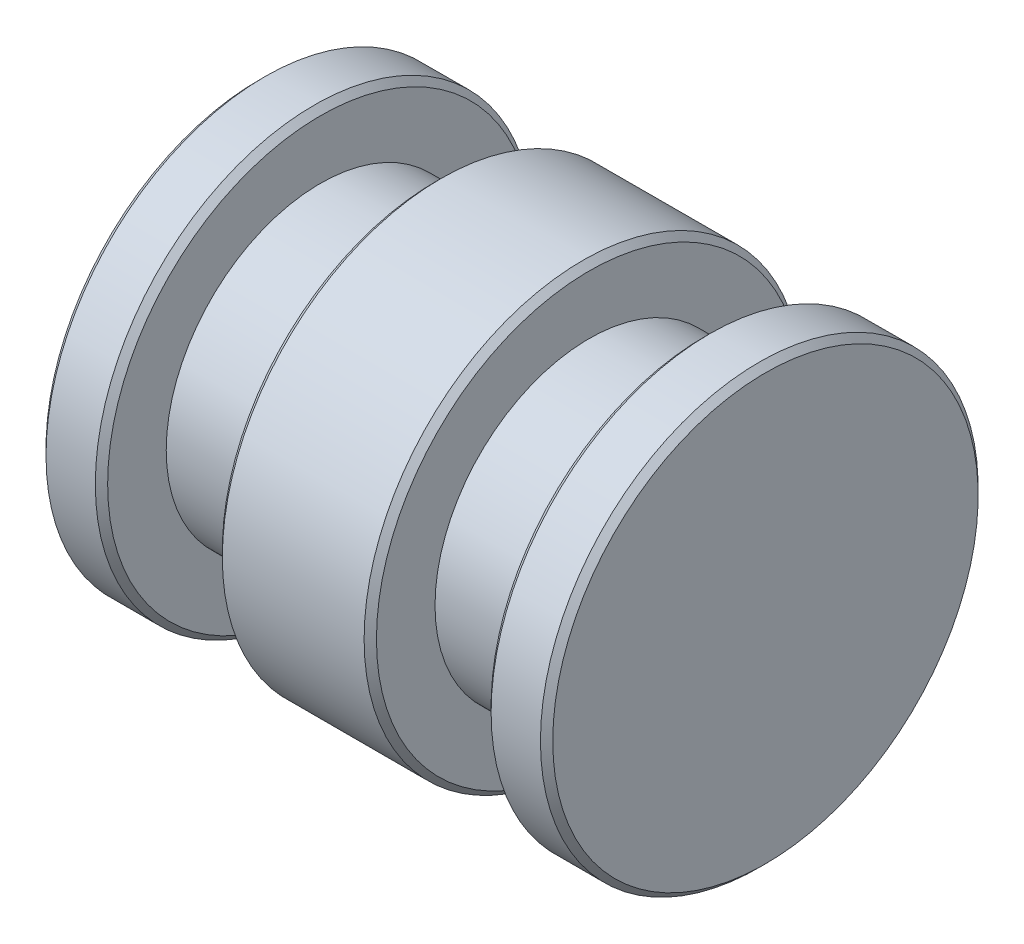
from build123d import *

# Parameters (mm, degrees)
VENT_EDGE_BREAK_SIZE = 0.127


with BuildPart() as part:
    # Sketch2 → Revolve1 (revolve)
    with BuildSketch(Plane.XY, mode=Mode.PRIVATE) as revolve1_sk:
        Polygon((3.6322, 4.5085), (3.6322, 3.175), (1.27, 3.175), (1.27, 4.5085), (0, 4.5085), (0, 0), (10.4394, 0), (10.4394, 4.5085), (9.1694, 4.5085), (9.1694, 3.175), (6.8072, 3.175), (6.8072, 4.5085), align=None)
    revolve(revolve1_sk.sketch.rotate(Axis((-1.617419624, 0, 0), (1, 0, 0)), 90), axis=Axis((-1.617419624, 0, 0), (1, 0, 0)))

    # vent-edge-break
    vent_edge_break_edges = [part.edges().sort_by_distance(p)[0] for p in [
        (3.6322, 0, -4.5085),
        (6.8072, 0, -4.5085),
        (9.1694, 0, -4.5085),
        (10.4394, 0, -4.5085),
        (0, 0, -4.5085),
        (1.27, 0, -4.5085),
    ]]
    chamfer(vent_edge_break_edges, length=VENT_EDGE_BREAK_SIZE)


solid = part.part
